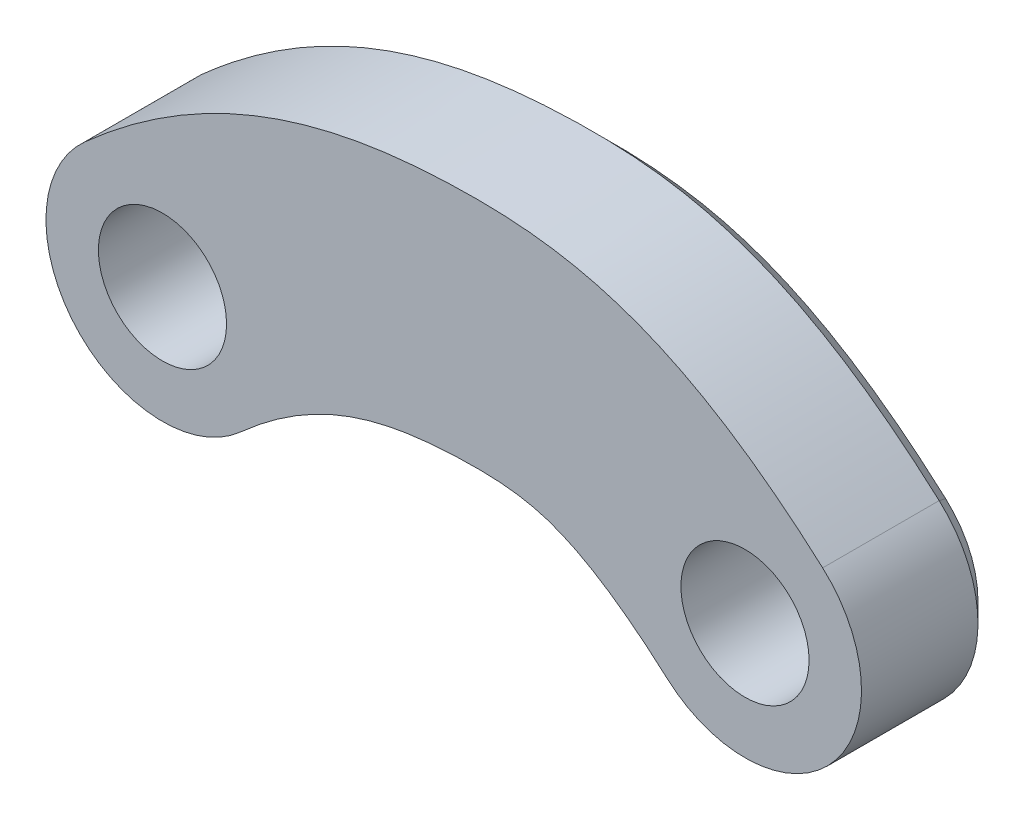
from build123d import *

# Parameters (mm, degrees)
SKETCH_1_R      = 1.65
EXTRUDE_2_DEPTH = 3.5
CHAMFER_1_SIZE  = 0.5


with BuildPart() as part:
    # 草图1 → 凸台-拉伸2 (new body)
    with BuildSketch(Plane.XY):
        with BuildLine():
            add(Edge.make_bspline(
                [(-2, 2.236067977), (1.298350605, 5.186202444), (7.70496537, 6.630470955), (13.291718654, 5.552855645), (17, 2.236067977)],
                knots=[0, 0, 0, 0, 0.5, 1, 1, 1, 1], degree=3))
            ThreePointArc((-2, 2.236067977), (-2.236067977, -2), (2, -2.236067977))
            add(Edge.make_bspline(
                [(2, -2.236067977), (2.133231621, -2.116901993), (2.413155894, -1.87779666), (2.92891001, -1.478504787), (3.538329614, -1.07495841), (4.2139596, -0.719034821), (5.07558679, -0.368617139), (5.940240482, -0.155045102), (6.888643765, -0.035603913), (7.691648693, 0.010168459), (8.44481537, 0.011741207), (9.02314593, -0.033114067), (9.5178697, -0.118274629), (9.991466761, -0.252962594), (10.526142012, -0.471507355), (11.180937128, -0.827124358), (11.86067581, -1.292530825), (12.478348447, -1.781196), (12.832651532, -2.086386958), (13, -2.236067977)],
                knots=[0, 0, 0, 0, 0.03125, 0.0625, 0.125, 0.1875, 0.25, 0.375, 0.4375, 0.5, 0.5625, 0.625, 0.6875, 0.75, 0.8125, 0.875, 0.9375, 0.96875, 1, 1, 1, 1], degree=3))
            ThreePointArc((13, -2.236067977), (17.236067977, -2), (17, 2.236067977))
        make_face()
        Circle(SKETCH_1_R, mode=Mode.SUBTRACT)
        with Locations((15, 0)):
            Circle(SKETCH_1_R, mode=Mode.SUBTRACT)
    extrude(amount=EXTRUDE_2_DEPTH)

    # 倒角1
    chamfer_1_edges = [part.edges().sort_by_distance(p)[0] for p in [
        (17.236067977, -2, 0),
        (7.532671852, -0.002579069, 0),
        (-2.236067977, -2, 0),
        (7.532671852, -0.002579069, 0),
    ]]
    chamfer(chamfer_1_edges, length=CHAMFER_1_SIZE)


solid = part.part
